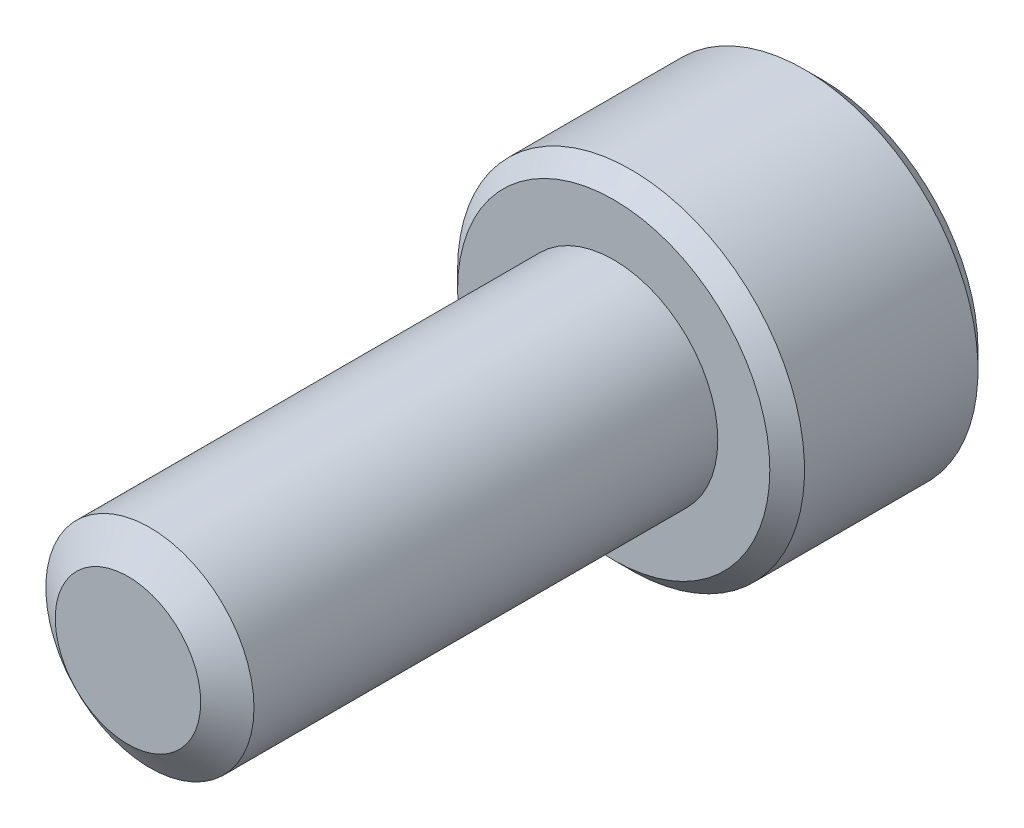
from build123d import *

# Parameters (mm, degrees)
SKETCH1_R          = 3
EXTRUDE1_DEPTH     = 14
SKETCH6_R          = 5
EXTRUDE2_DEPTH     = 6
CUT_EXTRUDE1_DEPTH = 3.75
CHAMFER1_SIZE      = 0.5


with BuildPart() as part:
    # Sketch1 → Extrude1 (new body)
    with BuildSketch(Plane.XY):
        Circle(SKETCH1_R)
    extrude(amount=-EXTRUDE1_DEPTH)

    # Sketch4 → Cut-Revolve1 (revolve, cut)
    with BuildSketch(Plane(origin=(0, 0, 0), x_dir=(0, 0, -1), z_dir=(1, 0, 0))):
        Polygon((0.632650852, 3), (0, 2.096480947), (0, 3), align=None)
    revolve(axis=Axis((0, 0, 0), (0, 0, -1)), mode=Mode.SUBTRACT)

    # Sketch6 → Extrude2 (add)
    with BuildSketch(Plane(origin=(0, 0, -14), x_dir=(-1, 0, 0), z_dir=(0, 0, -1))):
        Circle(SKETCH6_R)
    extrude(amount=EXTRUDE2_DEPTH)

    # Sketch7 → Cut-Extrude1 (cut)
    with BuildSketch(Plane(origin=(0, 0, -20), x_dir=(-1, 0, 0), z_dir=(0, 0, -1))):
        Polygon((0, 2.886751346), (-2.5, 1.443375673), (-2.5, -1.443375673), (0, -2.886751346), (2.5, -1.443375673), (2.5, 1.443375673), align=None)
    extrude(amount=-CUT_EXTRUDE1_DEPTH, mode=Mode.SUBTRACT)

    # Chamfer1
    chamfer1_edges = [part.edges().sort_by_distance(p)[0] for p in [
        (5, 0, -20),
        (5, 0, -14),
    ]]
    chamfer(chamfer1_edges, length=CHAMFER1_SIZE)


solid = part.part
